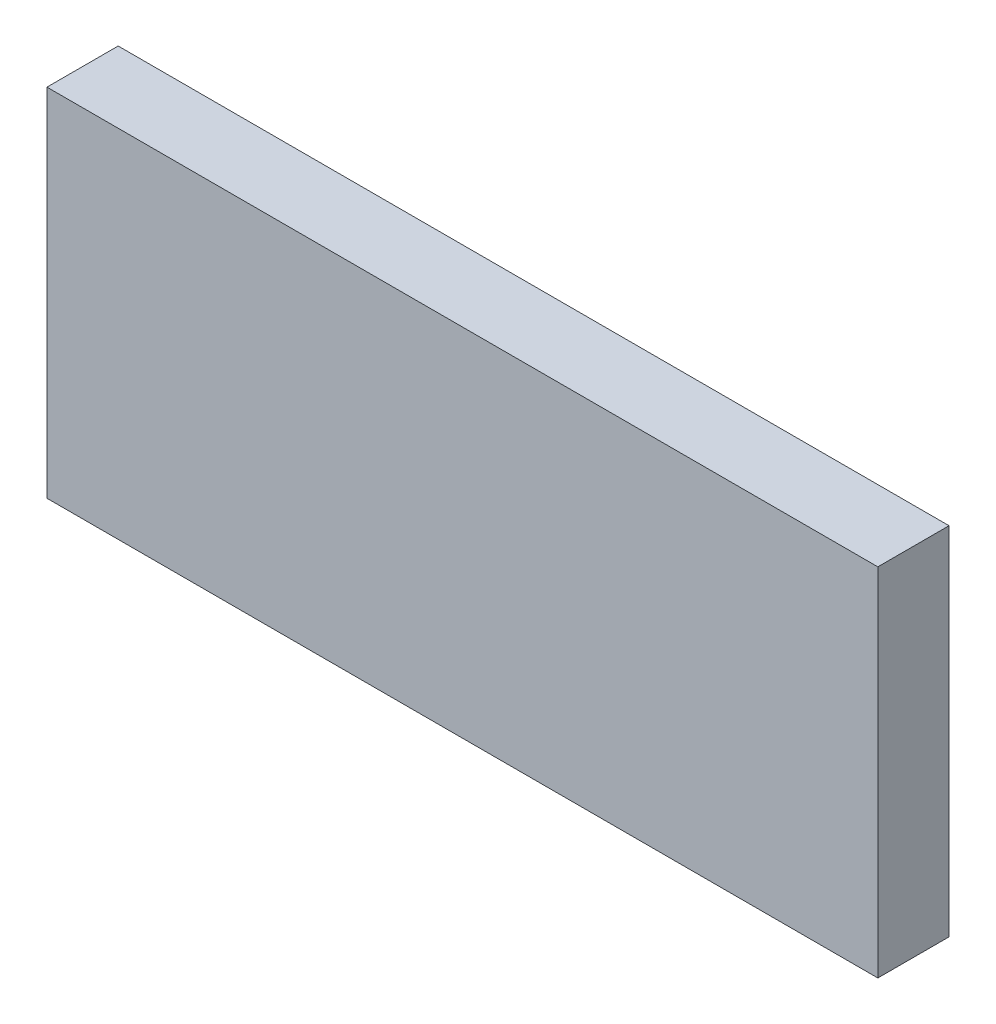
from build123d import *

# Parameters (mm, degrees)
SKETCH1_W           = 70
SKETCH1_H           = 30
BOSS_EXTRUDE1_DEPTH = 6


with BuildPart() as part:
    # Sketch1 → Boss-Extrude1 (new body)
    with BuildSketch(Plane.XY):
        with Locations((35, 15)):
            Rectangle(SKETCH1_W, SKETCH1_H)
    extrude(amount=BOSS_EXTRUDE1_DEPTH)


solid = part.part
